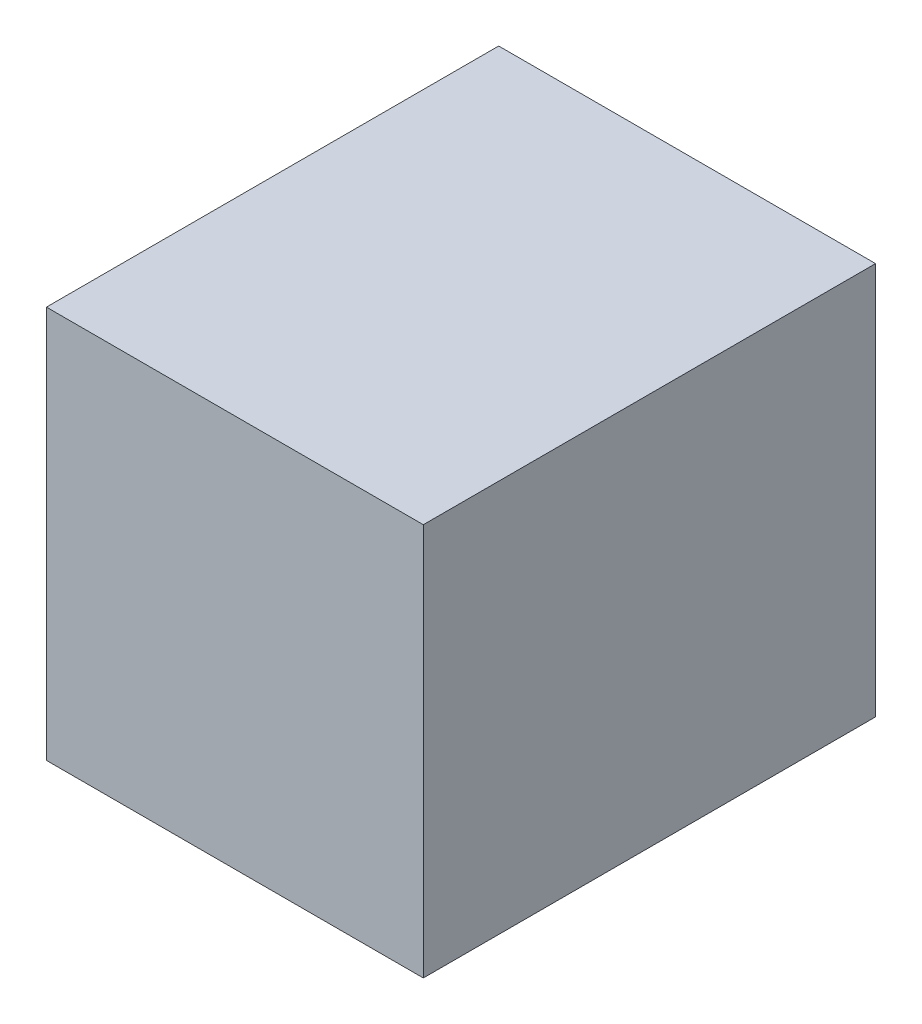
from build123d import *

# Parameters (mm, degrees)
SKETCH1_W           = 60
SKETCH1_H           = 72
BOSS_EXTRUDE1_DEPTH = 62.5


with BuildPart() as part:
    # Sketch1 → Boss-Extrude1 (new body)
    with BuildSketch(Plane(origin=(0, 0, 0), x_dir=(1, 0, 0), z_dir=(0, 1, 0))):
        Rectangle(SKETCH1_W, SKETCH1_H)
    extrude(amount=BOSS_EXTRUDE1_DEPTH)


solid = part.part
